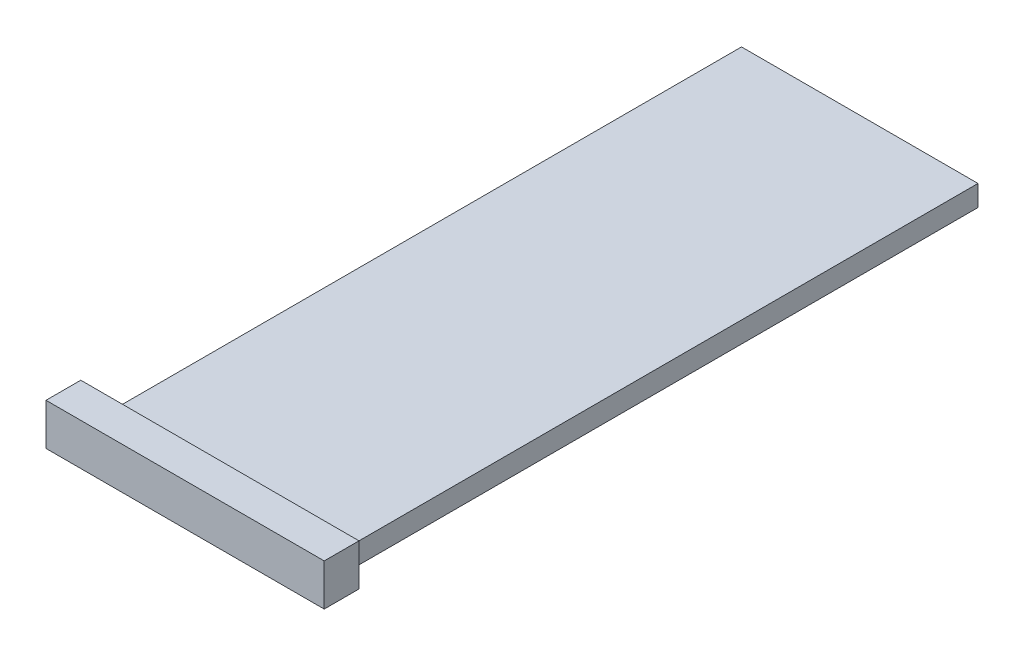
from build123d import *

# Parameters (mm, degrees)
SKETCH1_W           = 34
SKETCH1_H           = 6
BOSS_EXTRUDE1_DEPTH = 5
SKETCH2_W           = 34
SKETCH2_H           = 3
BOSS_EXTRUDE2_DEPTH = 92
BOSS_EXTRUDE3_DEPTH = 3
SKETCH4_W           = 5.001426655
SKETCH4_H           = 6
BOSS_EXTRUDE4_DEPTH = 3


with BuildPart() as part:
    # Sketch1 → Boss-Extrude1 (new body)
    with BuildSketch(Plane.XY):
        with Locations((-23.102564103, 9.466666667)):
            Rectangle(SKETCH1_W, SKETCH1_H)
    extrude(amount=-BOSS_EXTRUDE1_DEPTH)

    # Sketch2 → Boss-Extrude2 (add)
    with BuildSketch(Plane(origin=(0, 0, -5), x_dir=(-1, 0, 0), z_dir=(0, 0, -1))):
        with Locations((23.102564103, 7.966666667)):
            Rectangle(SKETCH2_W, SKETCH2_H)
    extrude(amount=BOSS_EXTRUDE2_DEPTH)

    # Sketch3 → Boss-Extrude3 (add)
    with BuildSketch(Plane.ZY.offset(40.102564103)):
        Polygon((-5, 9.466666667), (-5, 6.466666667), (0, 6.466666667), (0, 12.466666667), (-5, 12.466666667), align=None)
    extrude(amount=BOSS_EXTRUDE3_DEPTH)

    # Sketch4 → Boss-Extrude4 (add)
    with BuildSketch(Plane(origin=(-6.102564103, 0, 0), x_dir=(0, 0, -1), z_dir=(1, 0, 0))):
        with Locations((2.500713328, 9.466666667)):
            Rectangle(SKETCH4_W, SKETCH4_H)
    extrude(amount=BOSS_EXTRUDE4_DEPTH)


solid = part.part
